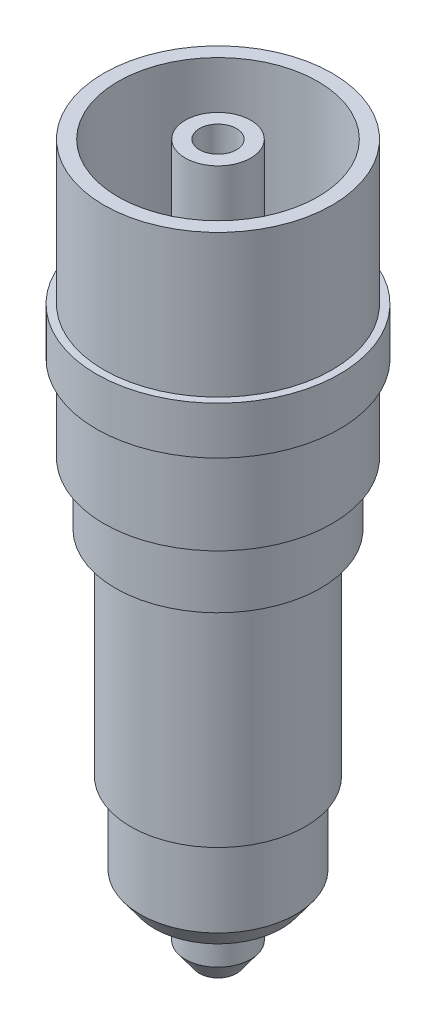
from build123d import *


with BuildPart() as part:
    # Sketch1 → Revolve8 (revolve)
    with BuildSketch(Plane.XY, mode=Mode.PRIVATE) as revolve8_sk:
        Polygon((-20.1311725, 30), (-20.1311725, 0), (-21.685493391, 0), (-21.685493391, -10), (-20.1311725, -10), (-20.1311725, -28), (-17.679129986, -28), (-17.679129986, -41), (-14.487787153, -41), (-14.487787153, -86), (-12.466786695, -86), (-12.466786695, -103), (-9.466786695, -107.090869704), (-9.466786695, -102.017880946), (-9.466786695, -83), (-11.487787153, -83), (-11.487787153, -38), (-14.679129986, -38), (-14.679129986, -25), (-17.1311725, -25), (-17.1311725, -7), (-18.685493391, -7), (-18.685493391, -3), (-17.1311725, -3), (-17.1311725, 27), (-17.1311725, 30), align=None)
        Polygon((0, 30), (0, -120), (-3, -115.909130296), (-3, -110.836141538), (-3, 27), (-3, 30), align=None)
    revolve(revolve8_sk.sketch.rotate(Axis((3.886409375, 30, 0), (0, -1, 0)), 270), axis=Axis((3.886409375, 30, 0), (0, -1, 0)))


solid = part.part
